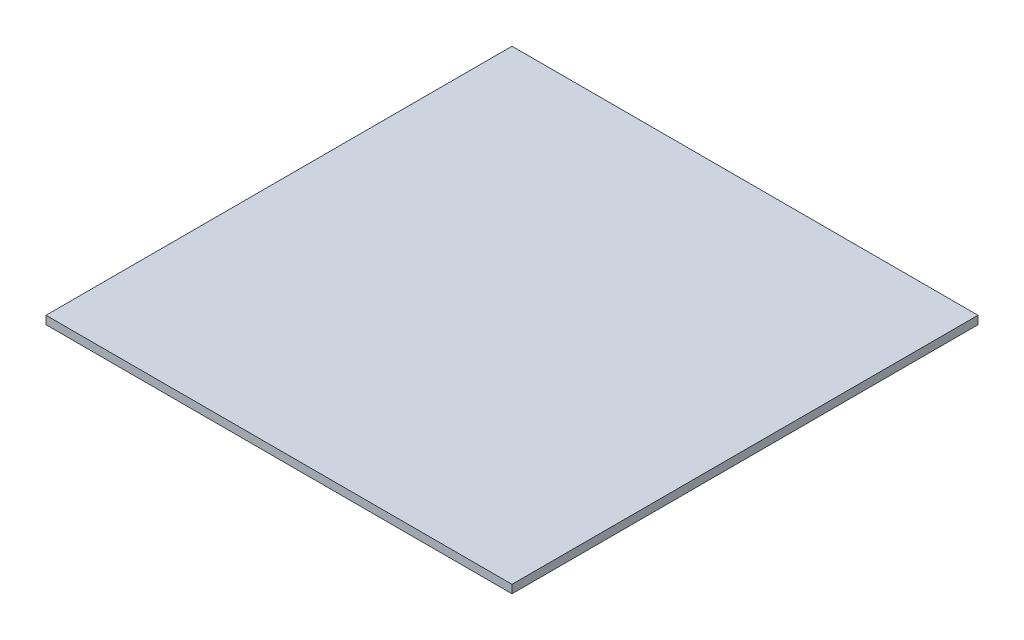
from build123d import *

# Parameters (mm, degrees)
SKETCH1_W           = 170
SKETCH1_H           = 170
BOSS_EXTRUDE1_DEPTH = 3


with BuildPart() as part:
    # Sketch1 → Boss-Extrude1 (new body)
    with BuildSketch(Plane(origin=(0, 0, 0), x_dir=(1, 0, 0), z_dir=(0, 1, 0))):
        Rectangle(SKETCH1_W, SKETCH1_H)
    extrude(amount=BOSS_EXTRUDE1_DEPTH)


solid = part.part
